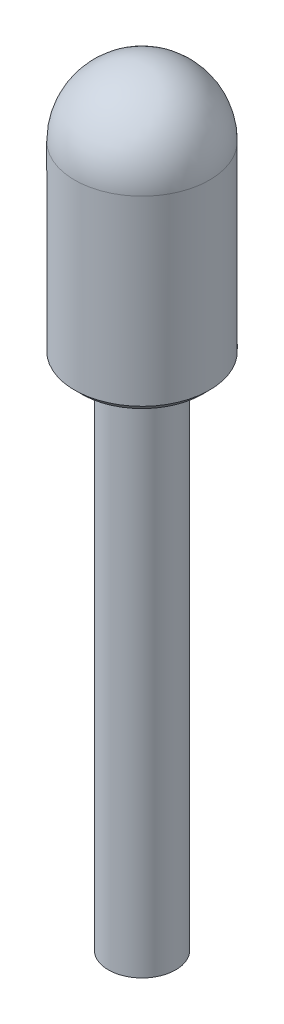
from build123d import *

# Parameters (mm, degrees)
CHAMFER1_SIZE = 0.1


with BuildPart() as part:
    # Sketch1 → Revolve1 (revolve)
    with BuildSketch(Plane.XY, mode=Mode.PRIVATE) as revolve1_sk:
        with BuildLine():
            Line((0, 0), (0.5, 0))
            Line((0.5, 0), (0.5, 7.6))
            Line((0.5, 7.6), (1, 7.6))
            Line((1, 7.6), (1, 10.4))
            ThreePointArc((1, 10.4), (0.707106781, 11.107106781), (0, 11.4))
            Line((0, 11.4), (0, 0))
        make_face()
    revolve(revolve1_sk.sketch.rotate(Axis((0, 0, 0), (0, 1, 0)), 90), axis=Axis((0, 0, 0), (0, 1, 0)))

    # Chamfer1
    chamfer1_edges = [part.edges().sort_by_distance(p)[0] for p in [
        (0, 7.6, 1),
    ]]
    chamfer(chamfer1_edges, length=CHAMFER1_SIZE)


solid = part.part
